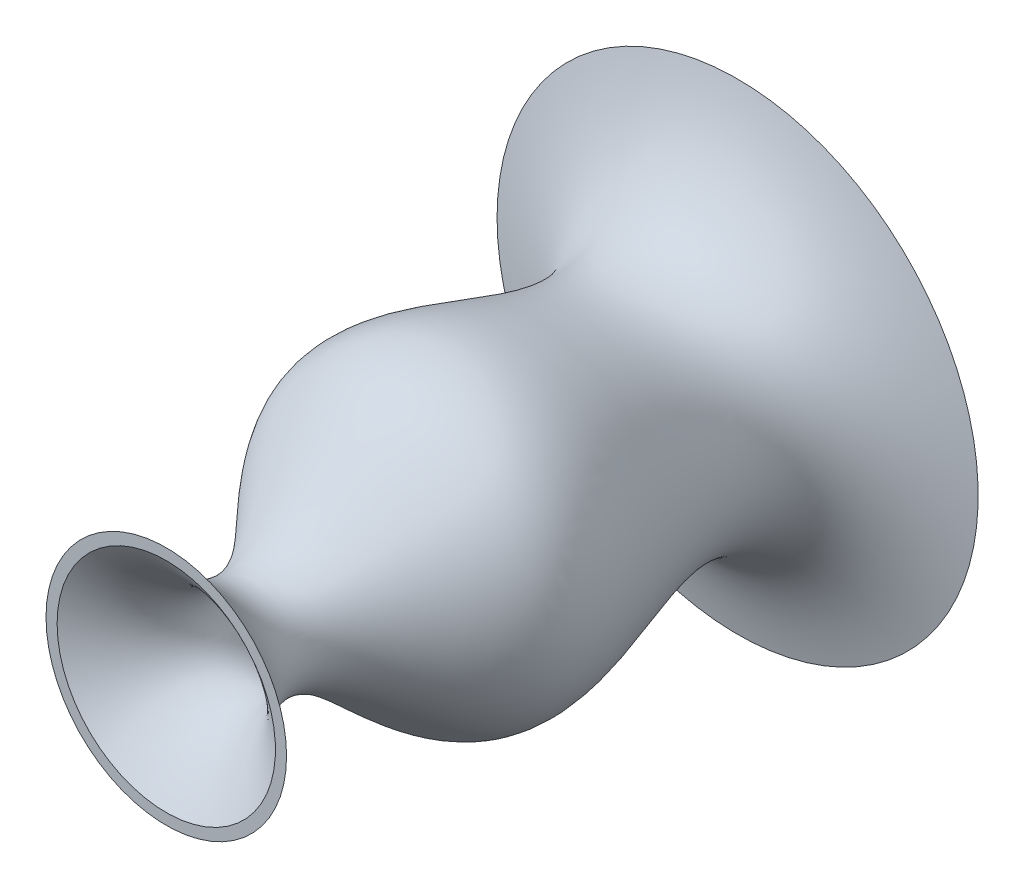
from build123d import *

# Parameters (mm, degrees)
SHELL1_T = -2.54


with BuildPart() as part:
    # Sketch1 → Revolve1 (revolve)
    with BuildSketch(Plane.YZ):
        with BuildLine():
            add(Edge.make_bspline(
                [(50.8, 241.3), (-17.17231624, 198.708109589), (140.989603279, 144.448815338), (-0.614962808, 24.649637459), (101.6, 0)],
                knots=[0, 0, 0, 0, 0.431374722, 1, 1, 1, 1], degree=3))
            Line((101.6, 0), (0, 0))
            Line((0, 0), (0, 241.3))
            Line((0, 241.3), (50.8, 241.3))
        make_face()
    revolve(axis=Axis((0, 0, 0), (0, 0, 1)))

    # Shell1
    shell1_openings = [part.faces().sort_by_distance(p)[0] for p in [
        (0, 0, 241.3),
    ]]
    offset(amount=SHELL1_T, openings=shell1_openings, kind=Kind.INTERSECTION)


solid = part.part
